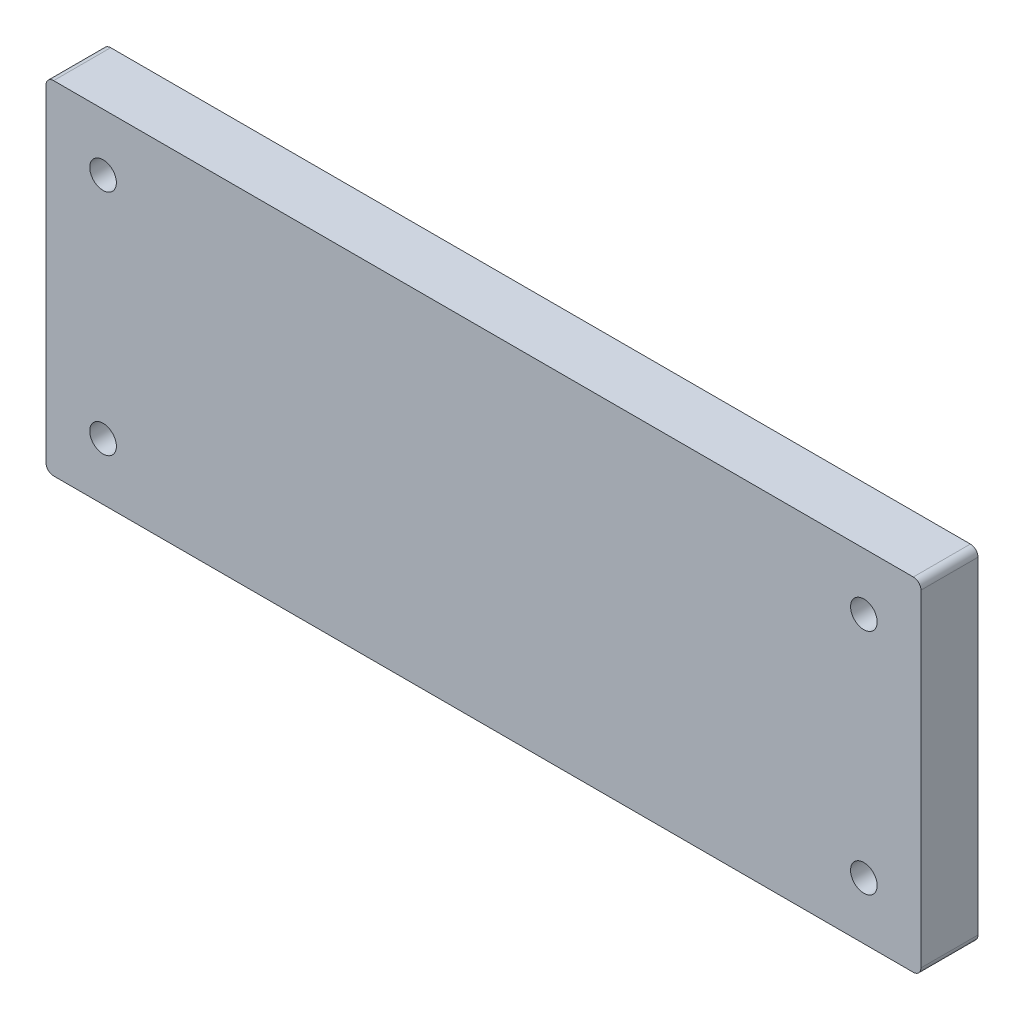
from build123d import *

# Parameters (mm, degrees)
SKIZZE1_W                       = 230
SKIZZE1_H                       = 90
AUFSATZ_LINEAR_AUSTRAGEN1_DEPTH = 15
F_7_0_7_DURCHMESSER_BOHRUNG1_D  = 7
VERRUNDUNG3_R                   = 2
VERRUNDUNG4_R                   = 2


with BuildPart() as part:
    # Skizze1 → Aufsatz-Linear austragen1 (new body)
    with BuildSketch(Plane.XY):
        Rectangle(SKIZZE1_W, SKIZZE1_H)
    extrude(amount=AUFSATZ_LINEAR_AUSTRAGEN1_DEPTH)

    # Ø7.0 (7) Durchmesser Bohrung1 (through all)
    with Locations(Plane.XY.offset(15)):
        with Locations((100, -30), (-100, -30), (-100, 30), (100, 30)):
            Hole(F_7_0_7_DURCHMESSER_BOHRUNG1_D / 2)

    # Verrundung3
    verrundung3_edges = [part.edges().sort_by_distance(p)[0] for p in [
        (-115, 45, 7.5),
        (115, 45, 7.5),
    ]]
    fillet(verrundung3_edges, radius=VERRUNDUNG3_R)

    # Verrundung4
    verrundung4_edges = [part.edges().sort_by_distance(p)[0] for p in [
        (115, -45, 7.5),
        (-115, -45, 7.5),
    ]]
    fillet(verrundung4_edges, radius=VERRUNDUNG4_R)


solid = part.part
